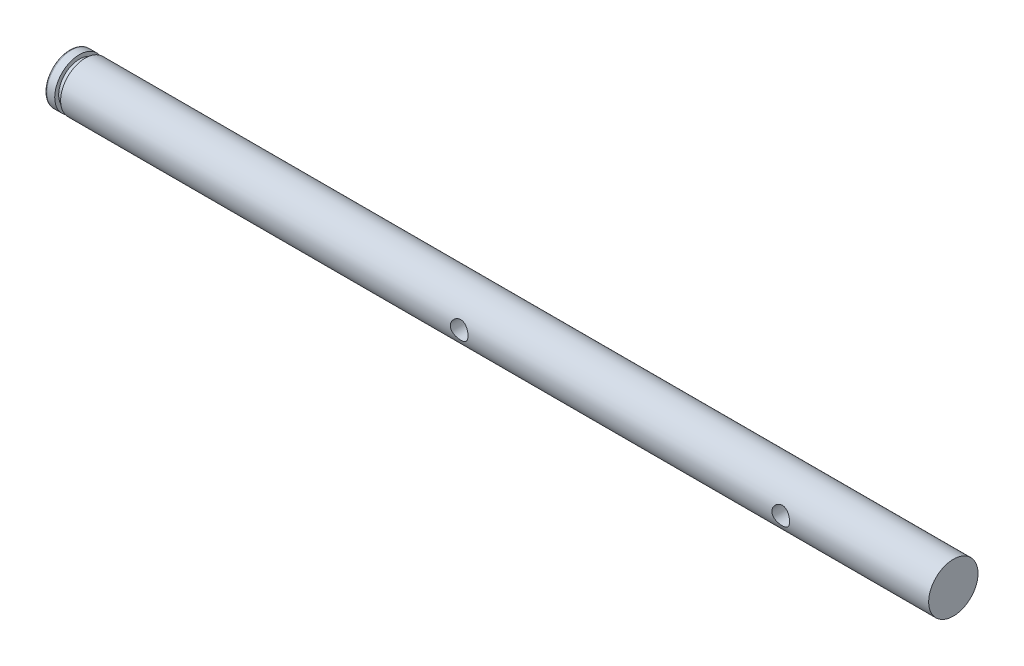
from build123d import *

# Parameters (mm, degrees)
SKETCH1_R               = 3.175
BOSS_EXTRUDE1_DEPTH     = 111.76
SKETCH2_R               = 2.667
BOSS_EXTRUDE2_DEPTH     = 0.762
SKETCH3_R               = 3.175
BOSS_EXTRUDE3_DEPTH     = 1.27
FILLET1_R               = 0.254
CUT_EXTRUDE1_DEPTH      = 114.880553719
CUT_EXTRUDE1_DEPTH_BACK = 114.880553719
SKETCH4_R               = 1.143


with BuildPart() as part:
    # Sketch1 → Boss-Extrude1 (new body)
    with BuildSketch(Plane(origin=(0, 0, 0), x_dir=(0, 0, -1), z_dir=(1, 0, 0))):
        Circle(SKETCH1_R)
    extrude(amount=-BOSS_EXTRUDE1_DEPTH)

    # Sketch2 → Boss-Extrude2 (add)
    with BuildSketch(Plane.ZY.offset(111.76)):
        with Locations(Location((0, 0, 0), (0, 0, 180))):
            Circle(SKETCH2_R)
    extrude(amount=BOSS_EXTRUDE2_DEPTH)

    # Sketch3 → Boss-Extrude3 (add)
    with BuildSketch(Plane.ZY.offset(112.522)):
        with Locations(Location((0, 0, 0), (0, 0, 180))):
            Circle(SKETCH3_R)
    extrude(amount=BOSS_EXTRUDE3_DEPTH)

    # Fillet1
    fillet1_edges = [part.edges().sort_by_distance(p)[0] for p in [
        (-113.792, 0, 3.175),
    ]]
    fillet(fillet1_edges, radius=FILLET1_R)

    # Sketch4 → Cut-Extrude1 (cut, two sides: drawn at the far end of the back side and taken through both)
    with BuildSketch(Plane.XY.offset(-CUT_EXTRUDE1_DEPTH_BACK)):
        with Locations((-60.452, 0)):
            Circle(SKETCH4_R)
        with Locations((-19.05, 0)):
            Circle(SKETCH4_R)
    extrude(amount=CUT_EXTRUDE1_DEPTH + CUT_EXTRUDE1_DEPTH_BACK, mode=Mode.SUBTRACT)


solid = part.part
